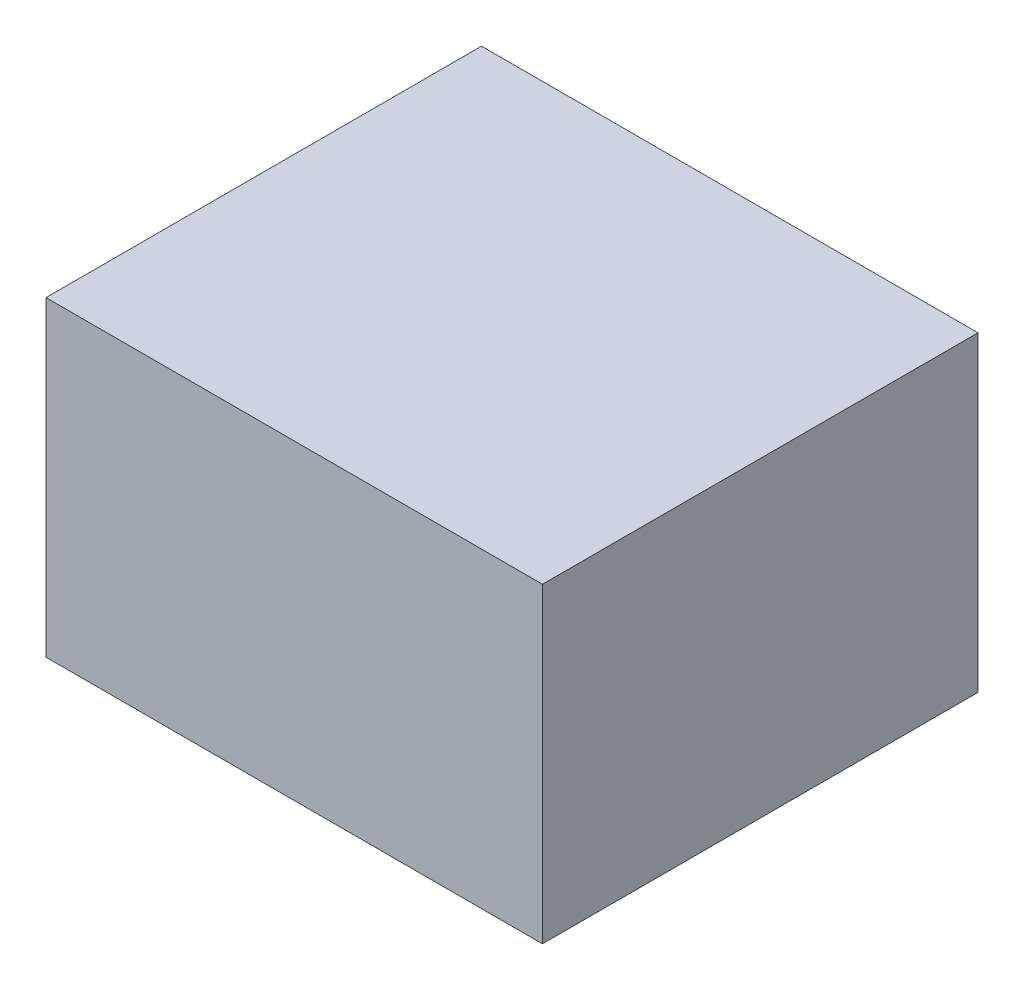
from build123d import *

# Parameters (mm, degrees)
SKETCH1_W           = 55.88
SKETCH1_H           = 49.022
BOSS_EXTRUDE1_DEPTH = 35.052
SKETCH2_R           = 3.175
BOSS_EXTRUDE2_DEPTH = 5.08


with BuildPart() as part:
    # Sketch1 → Boss-Extrude1 (new body)
    with BuildSketch(Plane(origin=(0, 0, 0), x_dir=(1, 0, 0), z_dir=(0, 1, 0))):
        with Locations((-2.72430839, -8.545285714)):
            Rectangle(SKETCH1_W, SKETCH1_H)
    extrude(amount=BOSS_EXTRUDE1_DEPTH)

    # Sketch2 → Boss-Extrude2 (add)
    with BuildSketch(Plane(origin=(0, 0, -15.965714286), x_dir=(-1, 0, 0), z_dir=(0, 0, -1))):
        with Locations(Location((-15.05569161, 17.526, 0), (0, 0, 180))):
            Circle(SKETCH2_R)
    extrude(amount=BOSS_EXTRUDE2_DEPTH)


solid = part.part
